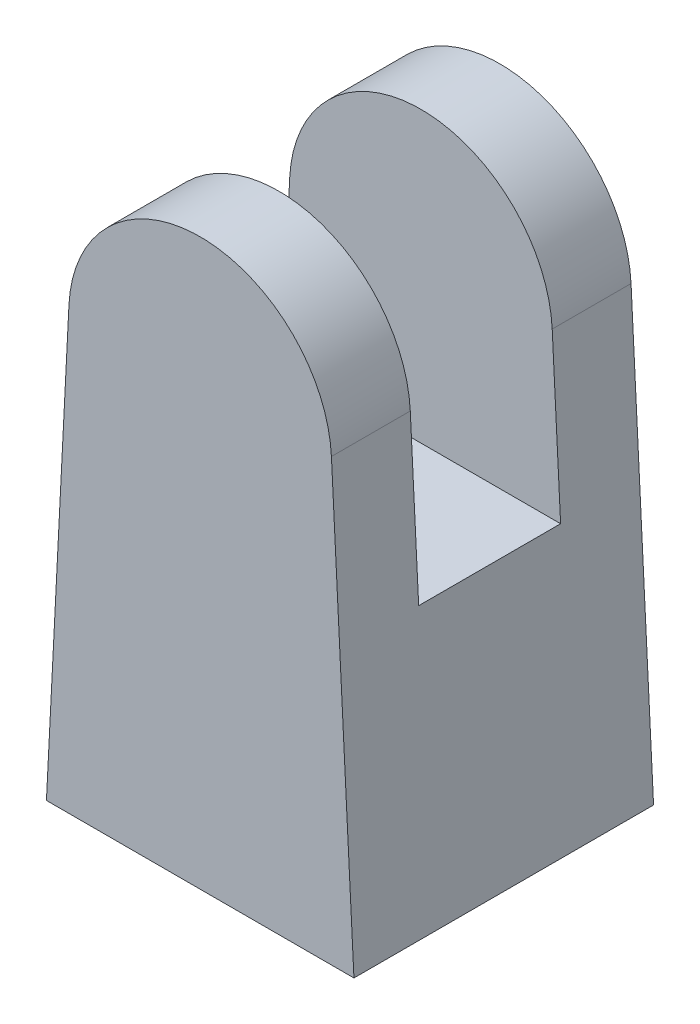
from build123d import *

# Parameters (mm, degrees)
BOSS_EXTRUDE1_DEPTH     = 57
SKETCH2_R               = 37.5
BOSS_EXTRUDE2_DEPTH     = 2
CUT_EXTRUDE1_DEPTH      = 186.90387301
CUT_EXTRUDE1_DEPTH_BACK = 186.90387301
SKETCH3_W               = 113.978189674
SKETCH3_H               = 54
BODY_MOVE_COPY1_ANGLE   = 90


with BuildPart() as part:
    # Sketch1 → Boss-Extrude1 (new, symmetric)
    with BuildSketch(Plane.XY):
        with BuildLine():
            Line((-165, -58.5), (-165, 58.5))
            Line((-165, 58.5), (2.552640416, 49.934797756))
            ThreePointArc((2.552640416, 49.934797756), (50, 0), (2.552640416, -49.934797756))
            Line((2.552640416, -49.934797756), (-165, -58.5))
        make_face()
    extrude(amount=BOSS_EXTRUDE1_DEPTH, both=True)

    # Sketch2 → Boss-Extrude2 (add)
    with BuildSketch(Plane.ZY.offset(165)):
        Circle(SKETCH2_R)
    extrude(amount=BOSS_EXTRUDE2_DEPTH)

    # Sketch3 → Cut-Extrude1 (cut, two sides: drawn at the far end of the back side and taken through both)
    with BuildSketch(Plane(origin=(0, 0, 0), x_dir=(1, 0, 0), z_dir=(0, 1, 0)).offset(-CUT_EXTRUDE1_DEPTH_BACK)):
        with Locations((-3.010905163, 0)):
            Rectangle(SKETCH3_W, SKETCH3_H)
    extrude(amount=CUT_EXTRUDE1_DEPTH + CUT_EXTRUDE1_DEPTH_BACK, mode=Mode.SUBTRACT)


with BuildPart() as part_1:
    # Body-Move/Copy1: moved
    add(part.part.rotate(Axis((0, 0, 0), (0, 0, 1)), BODY_MOVE_COPY1_ANGLE))


solid = part_1.part
